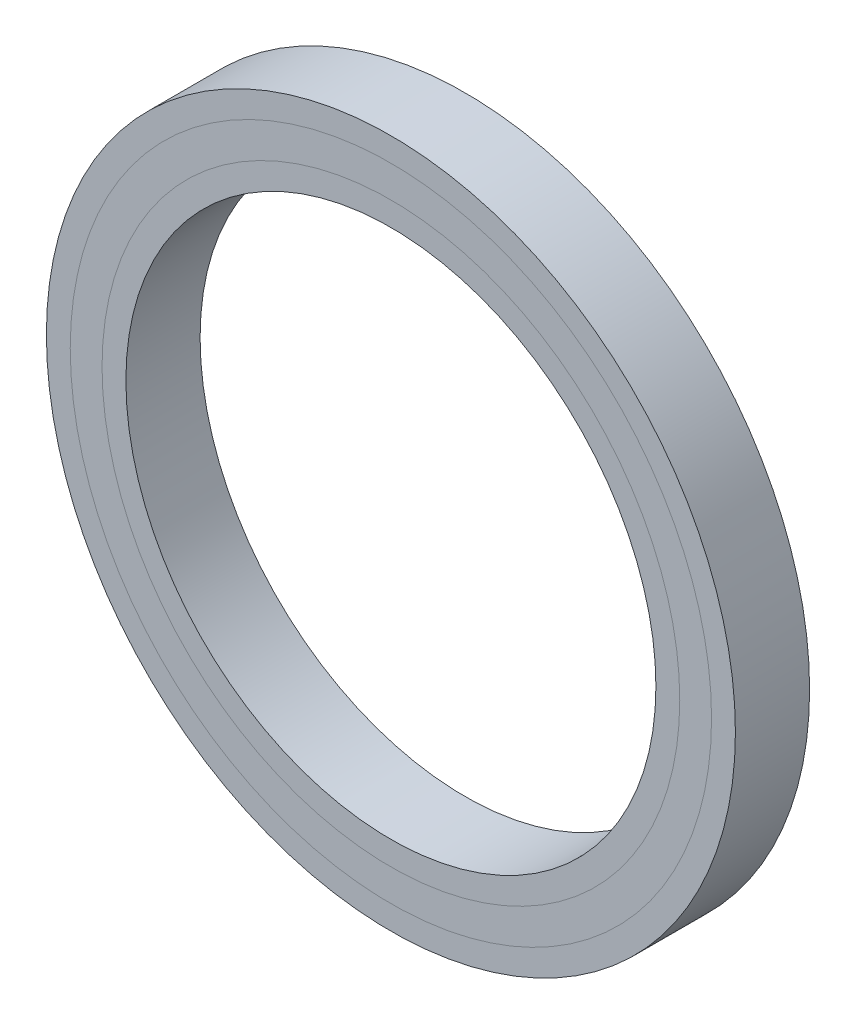
from build123d import *

# Parameters (mm, degrees)
SKETCH1_R           = 27.25
SKETCH1_R_2         = 25
BOSS_EXTRUDE1_DEPTH = 7
SKETCH3_R           = 30.25
SKETCH3_R_2         = 27.25
BOSS_EXTRUDE4_DEPTH = 7
SKETCH5_R           = 32.5
SKETCH5_R_2         = 30.25
BOSS_EXTRUDE5_DEPTH = 7


with BuildPart() as part:
    # Sketch1 → Boss-Extrude1 (new body)
    with BuildSketch(Plane.XY):
        Circle(SKETCH1_R)
        Circle(SKETCH1_R_2, mode=Mode.SUBTRACT)
    extrude(amount=BOSS_EXTRUDE1_DEPTH)


with BuildPart() as body_2:
    # Sketch3 → Boss-Extrude4 (new body)
    with BuildSketch(Plane.XY):
        Circle(SKETCH3_R)
        Circle(SKETCH3_R_2, mode=Mode.SUBTRACT)
    extrude(amount=BOSS_EXTRUDE4_DEPTH)


with BuildPart() as body_3:
    # Sketch5 → Boss-Extrude5 (new body)
    with BuildSketch(Plane.XY):
        Circle(SKETCH5_R)
        Circle(SKETCH5_R_2, mode=Mode.SUBTRACT)
    extrude(amount=BOSS_EXTRUDE5_DEPTH)


solid = Compound([part.part, body_2.part, body_3.part])
